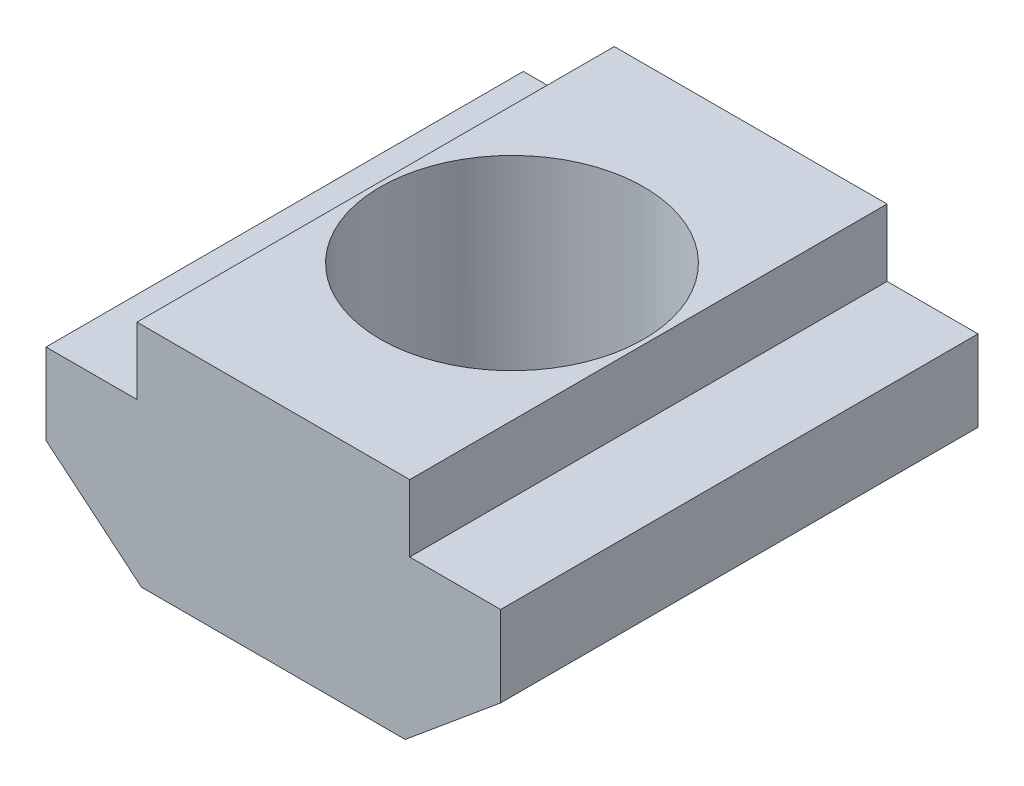
from build123d import *

# Parameters (mm, degrees)
BOSS_EXTRUDE1_DEPTH = 10.5
SKETCH2_R           = 2.9
CUT_EXTRUDE1_DEPTH  = 13.658988901


with BuildPart() as part:
    # Sketch1 → Boss-Extrude1 (new body)
    with BuildSketch(Plane.XY):
        Polygon((-2.9, -2.5), (2.9, -2.5), (5, -0.753968254), (5, 1.026031746), (3, 1.026031746), (3, 2.5), (-3, 2.5), (-3, 1.026031746), (-5, 1.026031746), (-5, -0.753968254), align=None)
    extrude(amount=BOSS_EXTRUDE1_DEPTH)

    # Sketch2 → Cut-Extrude1 (cut, through all)
    with BuildSketch(Plane(origin=(0, 2.5, 0), x_dir=(1, 0, 0), z_dir=(0, 1, 0))):
        with Locations(Location((0, -5.25, 0), (0, 0, 270))):
            Circle(SKETCH2_R)
    extrude(amount=-CUT_EXTRUDE1_DEPTH, mode=Mode.SUBTRACT)


solid = part.part
